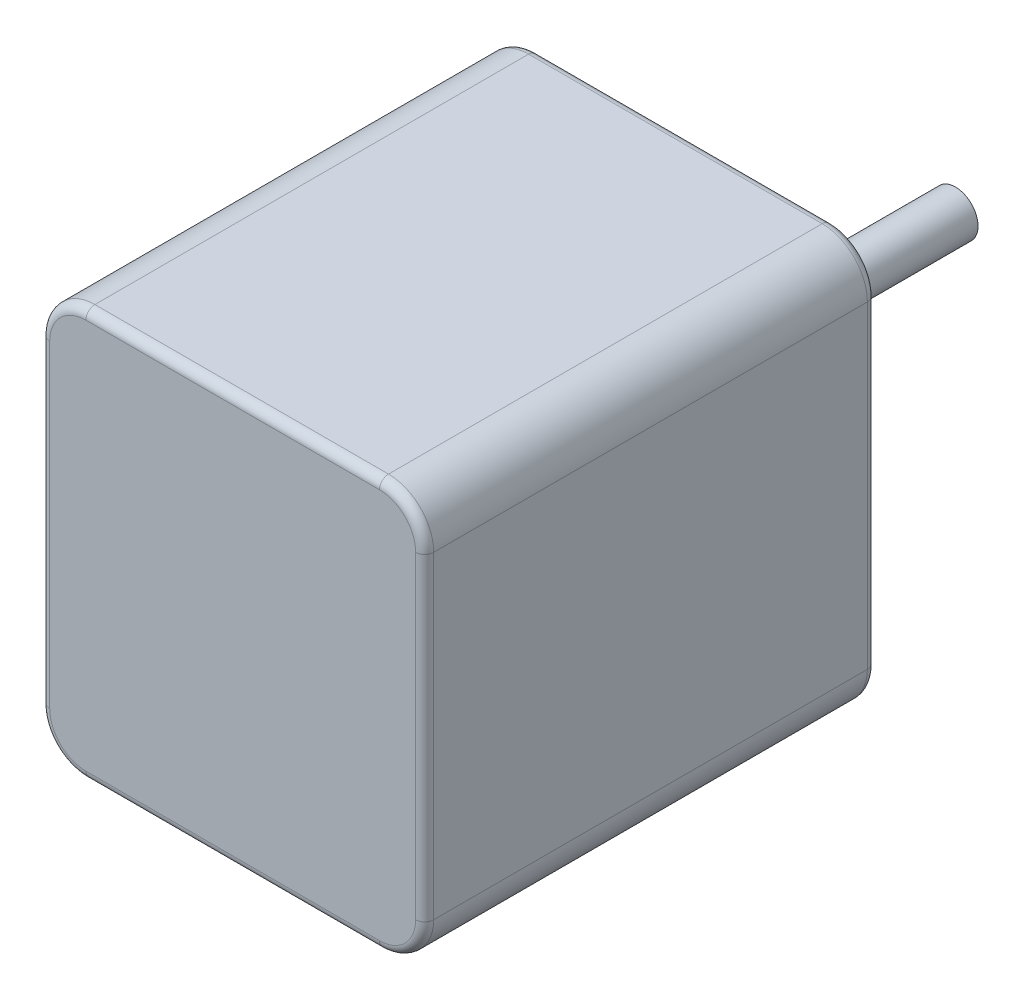
from build123d import *

# Parameters (mm, degrees)
ESQUISSE1_W        = 42.5
ESQUISSE1_H        = 45.220937172
BOSS_EXTRU_1_DEPTH = 50
ESQUISSE2_R        = 2.5
BOSS_EXTRU_2_DEPTH = 30
CONG_1_R           = 5
CONG_2_R           = 1
CONG_3_R           = 1


with BuildPart() as part:
    # Esquisse1 → Boss.-Extru.1 (new body)
    with BuildSketch(Plane.XY):
        Rectangle(ESQUISSE1_W, ESQUISSE1_H)
    extrude(amount=BOSS_EXTRU_1_DEPTH)

    # Esquisse2 → Boss.-Extru.2 (add)
    with BuildSketch(Plane(origin=(0, 0, 0), x_dir=(-1, 0, 0), z_dir=(0, 0, -1))):
        Circle(ESQUISSE2_R)
    extrude(amount=BOSS_EXTRU_2_DEPTH)

    # Congé1
    cong_1_edges = [part.edges().sort_by_distance(p)[0] for p in [
        (21.25, -22.610468586, 25),
        (-21.25, -22.610468586, 25),
        (-21.25, 22.610468586, 25),
        (21.25, 22.610468586, 25),
    ]]
    fillet(cong_1_edges, radius=CONG_1_R)

    # Congé2
    cong_2_edges = [part.edges().sort_by_distance(p)[0] for p in [
        (-21.25, 0, 50),
        (0, 22.610468586, 50),
        (21.25, 0, 50),
        (0, -22.610468586, 50),
        (19.785533906, 21.146002492, 50),
        (19.785533906, -21.146002492, 50),
        (-19.785533906, -21.146002492, 50),
        (-19.785533906, 21.146002492, 50),
    ]]
    fillet(cong_2_edges, radius=CONG_2_R)

    # Congé3
    cong_3_edges = [part.edges().sort_by_distance(p)[0] for p in [
        (-21.25, 0, 0),
        (21.25, 0, 0),
        (0, -22.610468586, 0),
        (0, 22.610468586, 0),
        (19.785533906, 21.146002492, 0),
        (19.785533906, -21.146002492, 0),
        (-19.785533906, -21.146002492, 0),
        (-19.785533906, 21.146002492, 0),
    ]]
    fillet(cong_3_edges, radius=CONG_3_R)


solid = part.part
